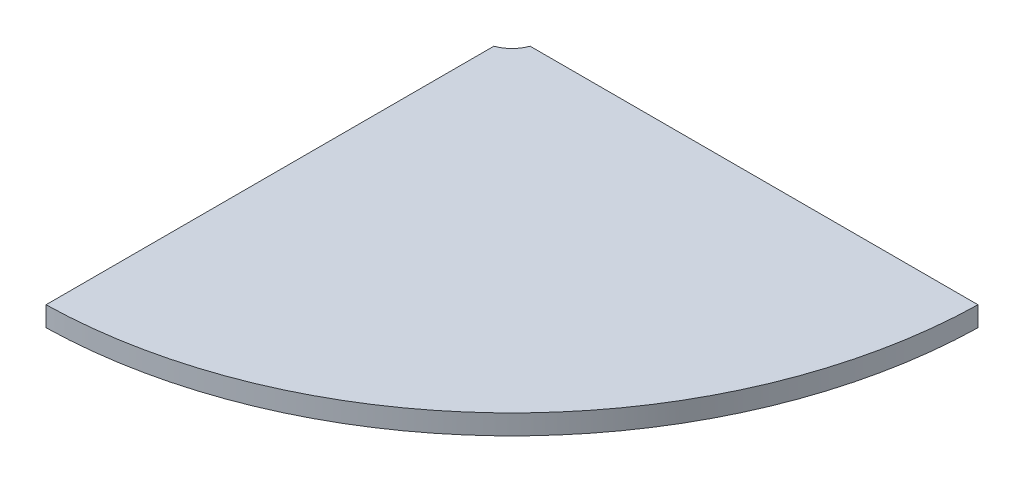
from build123d import *

# Parameters (mm, degrees)
SALIENTE_EXTRUIR1_DEPTH = 10


with BuildPart() as part:
    # Croquis1 → Saliente-Extruir1 (new body)
    with BuildSketch(Plane(origin=(0, 0, 0), x_dir=(1, 0, 0), z_dir=(0, 1, 0))):
        with BuildLine():
            Line((238.908053027, -4.875171273), (14.013304172, -4.875171273))
            ThreePointArc((14.013304172, -4.875171273), (10.492034584, -10.45915283), (4.908053027, -13.980422419))
            Line((4.908053027, -13.980422419), (4.908053027, -238.875171273))
            ThreePointArc((4.908053027, -238.875171273), (168.949166076, -168.916284323), (238.908053027, -4.875171273))
        make_face()
    extrude(amount=SALIENTE_EXTRUIR1_DEPTH)


solid = part.part
